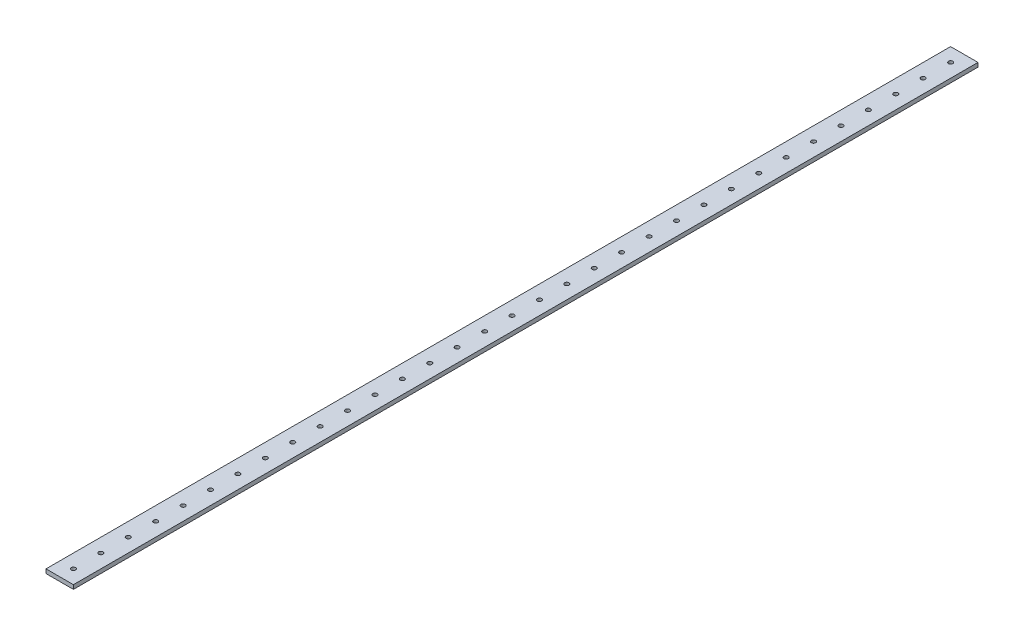
from build123d import *

# Parameters (mm, degrees)
SKETCH_1_W          = 20
SKETCH_1_H          = 3
EXTRUDE_1_DEPTH     = 660
SKETCH_2_R          = 1.575
CUT_EXTRUDE_1_DEPTH = 661.309775787


with BuildPart() as part:
    # 草图1 → 凸台-拉伸1 (new body)
    with BuildSketch(Plane.XY):
        with Locations((10, -1.5)):
            Rectangle(SKETCH_1_W, SKETCH_1_H)
    extrude(amount=EXTRUDE_1_DEPTH)

    # 草图2 → 切除-拉伸1 (cut, through all)
    with BuildSketch(Plane(origin=(0, 0, 0), x_dir=(1, 0, 0), z_dir=(0, 1, 0))):
        with Locations(Location((10, -10, 0), (0, 0, 270))):
            Circle(SKETCH_2_R)
        with Locations(Location((10, -30, 0), (0, 0, 270))):
            Circle(SKETCH_2_R)
        with Locations(Location((10, -50, 0), (0, 0, 270))):
            Circle(SKETCH_2_R)
        with Locations(Location((10, -70, 0), (0, 0, 270))):
            Circle(SKETCH_2_R)
        with Locations(Location((10, -90, 0), (0, 0, 270))):
            Circle(SKETCH_2_R)
        with Locations(Location((10, -110, 0), (0, 0, 270))):
            Circle(SKETCH_2_R)
        with Locations(Location((10, -130, 0), (0, 0, 270))):
            Circle(SKETCH_2_R)
        with Locations(Location((10, -150, 0), (0, 0, 270))):
            Circle(SKETCH_2_R)
        with Locations(Location((10, -170, 0), (0, 0, 270))):
            Circle(SKETCH_2_R)
        with Locations(Location((10, -190, 0), (0, 0, 270))):
            Circle(SKETCH_2_R)
        with Locations(Location((10, -210, 0), (0, 0, 270))):
            Circle(SKETCH_2_R)
        with Locations(Location((10, -230, 0), (0, 0, 270))):
            Circle(SKETCH_2_R)
        with Locations(Location((10, -250, 0), (0, 0, 270))):
            Circle(SKETCH_2_R)
        with Locations(Location((10, -270, 0), (0, 0, 270))):
            Circle(SKETCH_2_R)
        with Locations(Location((10, -290, 0), (0, 0, 270))):
            Circle(SKETCH_2_R)
        with Locations(Location((10, -310, 0), (0, 0, 270))):
            Circle(SKETCH_2_R)
        with Locations(Location((10, -330, 0), (0, 0, 270))):
            Circle(SKETCH_2_R)
        with Locations(Location((10, -350, 0), (0, 0, 270))):
            Circle(SKETCH_2_R)
        with Locations(Location((10, -370, 0), (0, 0, 270))):
            Circle(SKETCH_2_R)
        with Locations(Location((10, -390, 0), (0, 0, 270))):
            Circle(SKETCH_2_R)
        with Locations(Location((10, -410, 0), (0, 0, 270))):
            Circle(SKETCH_2_R)
        with Locations(Location((10, -430, 0), (0, 0, 270))):
            Circle(SKETCH_2_R)
        with Locations(Location((10, -450, 0), (0, 0, 270))):
            Circle(SKETCH_2_R)
        with Locations(Location((10, -470, 0), (0, 0, 270))):
            Circle(SKETCH_2_R)
        with Locations(Location((10, -490, 0), (0, 0, 270))):
            Circle(SKETCH_2_R)
        with Locations(Location((10, -510, 0), (0, 0, 270))):
            Circle(SKETCH_2_R)
        with Locations(Location((10, -530, 0), (0, 0, 270))):
            Circle(SKETCH_2_R)
        with Locations(Location((10, -550, 0), (0, 0, 270))):
            Circle(SKETCH_2_R)
        with Locations(Location((10, -570, 0), (0, 0, 270))):
            Circle(SKETCH_2_R)
        with Locations(Location((10, -590, 0), (0, 0, 270))):
            Circle(SKETCH_2_R)
        with Locations(Location((10, -610, 0), (0, 0, 270))):
            Circle(SKETCH_2_R)
        with Locations(Location((10, -630, 0), (0, 0, 270))):
            Circle(SKETCH_2_R)
        with Locations(Location((10, -650, 0), (0, 0, 270))):
            Circle(SKETCH_2_R)
    extrude(amount=-CUT_EXTRUDE_1_DEPTH, mode=Mode.SUBTRACT)


solid = part.part
